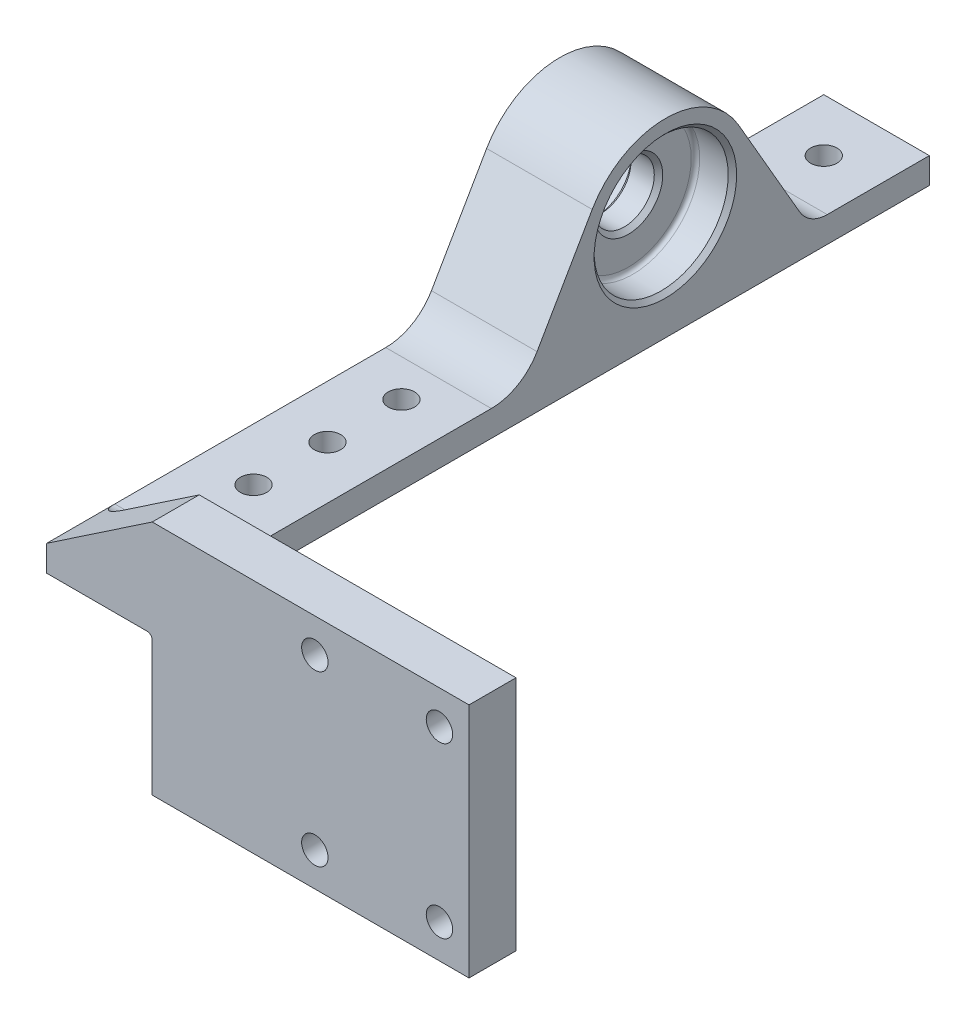
from build123d import *

# Parameters (mm, degrees)
SKETCH2_R                   = 3.6195
BEARING_MOUNT_DEPTH         = 6.35
SKETCH3_R                   = 8.0645
BEARING_HOLE_DEPTH          = 4.445
FILLET1_R                   = 6.35
FILLET2_R                   = 0.508
CHAMFER1_SIZE               = 0.508
SKETCH4_W                   = 5.652455718
SKETCH4_H                   = 28.448
MOTOR_MOUNT_DEPTH           = 38.1
FILLET3_R                   = 3.81
MOTOR_MOUNT_STIFFENER_DEPTH = 5.652455718
SKETCH6_R                   = 1.5875
MOTOR_PLATE_HOLES_DEPTH     = 102.044029057
FILLET4_R                   = 0.635
SKETCH7_R                   = 1.5875
MOUNT_HOLES_DEPTH           = 123.601249713
FILLET5_R                   = 2.54


with BuildPart() as part:
    # Sketch2 → Bearing_Mount (new, symmetric)
    with BuildSketch(Plane(origin=(0, 0, 0), x_dir=(0, 0, -1), z_dir=(1, 0, 0))):
        with BuildLine():
            Line((-19.05, 0), (-112.517680526, 0))
            Line((-112.517680526, 0), (-112.517680526, 3.1115))
            Line((-112.517680526, 3.1115), (-68.067680526, 3.1115))
            Line((-68.067680526, 3.1115), (-59.598818102, 17.78))
            ThreePointArc((-59.598818102, 17.78), (-50.8, 22.86), (-42.001181898, 17.78))
            Line((-42.001181898, 17.78), (-33.532319474, 3.1115))
            Line((-33.532319474, 3.1115), (-19.05, 3.1115))
            Line((-19.05, 3.1115), (-19.05, 0))
        make_face()
        with Locations((-50.8, 12.7)):
            Circle(SKETCH2_R, mode=Mode.SUBTRACT)
    extrude(amount=BEARING_MOUNT_DEPTH, both=True)

    # Sketch3 → Bearing_Hole (cut)
    with BuildSketch(Plane(origin=(6.35, 0, 0), x_dir=(0, 0, -1), z_dir=(1, 0, 0))):
        with Locations((-50.8, 12.7)):
            Circle(SKETCH3_R)
    bearing_hole = extrude(amount=-BEARING_HOLE_DEPTH, mode=Mode.SUBTRACT)

    # Mirror1: Bearing_Hole across plane
    add(bearing_hole.mirror(Plane(origin=(0, 0, 0), x_dir=(0, 0, 1), z_dir=(1, 0, 0))), mode=Mode.SUBTRACT)

    # Fillet1
    fillet1_edges = [part.edges().sort_by_distance(p)[0] for p in [
        (0, 3.1115, 68.067680526),
    ]]
    fillet(fillet1_edges, radius=FILLET1_R)

    # Fillet2
    fillet2_edges = [part.edges().sort_by_distance(p)[0] for p in [
        (1.905, 12.7, 58.8645),
        (-1.905, 12.7, 58.8645),
    ]]
    fillet(fillet2_edges, radius=FILLET2_R)

    # Chamfer1
    chamfer1_edges = [part.edges().sort_by_distance(p)[0] for p in [
        (1.905, 12.7, 54.4195),
        (6.35, 12.7, 58.8645),
        (-6.35, 12.7, 58.8645),
        (-1.905, 12.7, 54.4195),
    ]]
    chamfer(chamfer1_edges, length=CHAMFER1_SIZE)

    # Sketch4 → Motor_Mount (add)
    with BuildSketch(Plane(origin=(6.35, 0, 0), x_dir=(0, 0, -1), z_dir=(1, 0, 0))):
        with Locations((-109.691452667, -2.54)):
            Rectangle(SKETCH4_W, SKETCH4_H)
    extrude(amount=MOTOR_MOUNT_DEPTH)

    # Fillet3
    fillet3_edges = [part.edges().sort_by_distance(p)[0] for p in [
        (0, 3.1115, 33.532319474),
    ]]
    fillet(fillet3_edges, radius=FILLET3_R)

    # Sketch5 → Motor_Mount_Stiffener (add)
    with BuildSketch(Plane.XY.offset(112.517680526)):
        Polygon((6.35, 11.684), (-6.35, 3.1115), (6.35, 3.1115), align=None)
    extrude(amount=-MOTOR_MOUNT_STIFFENER_DEPTH)

    # Sketch6 → Motor_Plate_Holes (cut, through all)
    with BuildSketch(Plane(origin=(0, 0, 106.865224808), x_dir=(-1, 0, 0), z_dir=(0, 0, -1))):
        with Locations((-40.894, 7.62)):
            Circle(SKETCH6_R)
        with Locations((-25.908, 7.62)):
            Circle(SKETCH6_R)
        with Locations((-40.894, -12.7)):
            Circle(SKETCH6_R)
        with Locations((-25.908, -12.7)):
            Circle(SKETCH6_R)
    extrude(amount=-MOTOR_PLATE_HOLES_DEPTH, mode=Mode.SUBTRACT)

    # Fillet4
    fillet4_edges = [part.edges().sort_by_distance(p)[0] for p in [
        (6.35, 0, 109.691452667),
    ]]
    fillet(fillet4_edges, radius=FILLET4_R)

    # Sketch7 → Mount-Holes (cut, through all)
    with BuildSketch(Plane(origin=(0, 3.1115, 0), x_dir=(1, 0, 0), z_dir=(0, 1, 0))):
        with Locations(Location((0, -25.4, 0), (0, 0, 270))):
            Circle(SKETCH7_R)
        with Locations(Location((0, -76.2, 0), (0, 0, 270))):
            Circle(SKETCH7_R)
        with Locations(Location((0, -85.09, 0), (0, 0, 270))):
            Circle(SKETCH7_R)
        with Locations(Location((0, -93.98, 0), (0, 0, 270))):
            Circle(SKETCH7_R)
    extrude(amount=-MOUNT_HOLES_DEPTH, mode=Mode.SUBTRACT)

    # Fillet5
    fillet5_edges = [part.edges().sort_by_distance(p)[0] for p in [
        (0, 3.1115, 106.865224808),
    ]]
    fillet(fillet5_edges, radius=FILLET5_R)


solid = part.part
